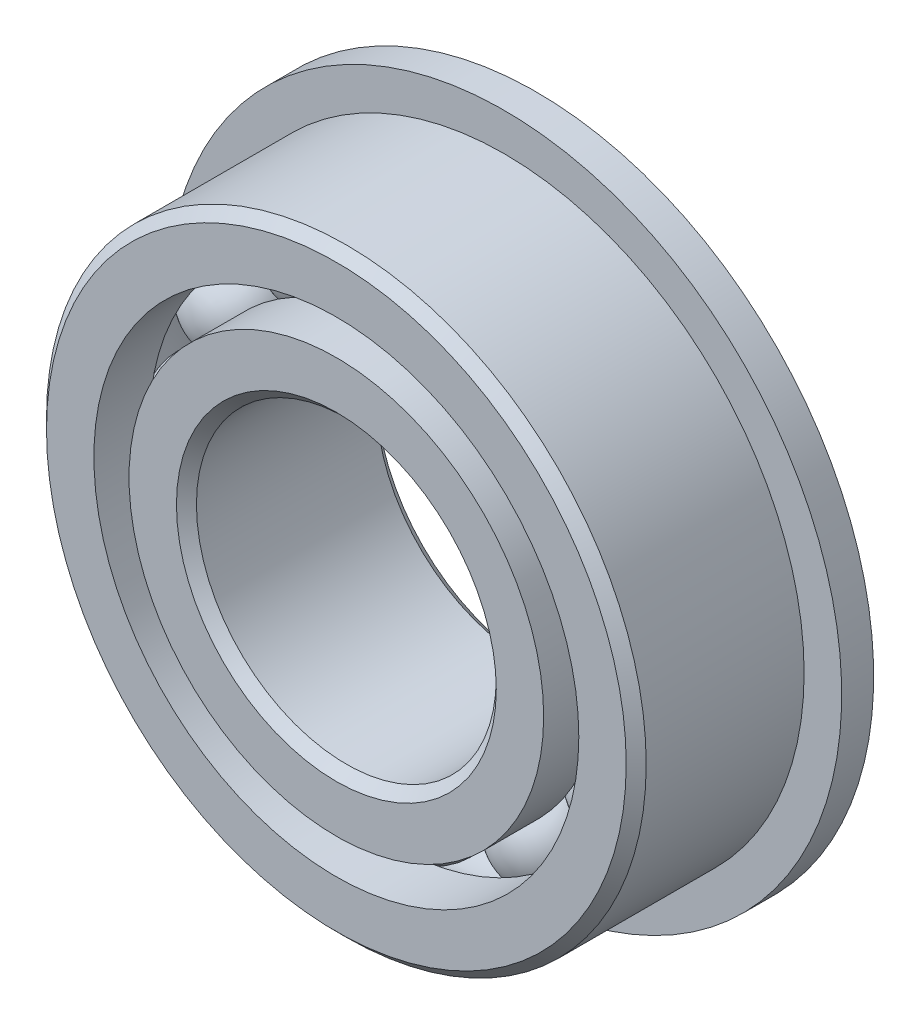
from build123d import *

# Parameters (mm, degrees)
CIRPATTERN1_COUNT = 12
SKETCH6_W         = 0.508
SKETCH6_H         = 1.508404121


with BuildPart() as part:
    # Sketch1 → Revolve1 (revolve)
    with BuildSketch(Plane(origin=(0, 0, 0), x_dir=(0, 0, -1), z_dir=(1, 0, 0))):
        with BuildLine():
            Line((1.42875, 4.7625), (-1.42875, 4.7625))
            Line((-1.42875, 4.7625), (-1.5875, 4.60375))
            Line((-1.5875, 4.60375), (-1.5875, 3.850995879))
            Line((-1.5875, 3.850995879), (-0.705555556, 3.850995879))
            ThreePointArc((-0.705555556, 3.850995879), (0, 4.330635244), (0.705555556, 3.850995879))
            Line((0.705555556, 3.850995879), (1.5875, 3.850995879))
            Line((1.5875, 3.850995879), (1.5875, 4.60375))
            Line((1.5875, 4.60375), (1.42875, 4.7625))
        make_face()
    revolve(axis=Axis((0, 0, 1.5875), (0, 0, -1)))

    # Sketch6 → Revolve6 (revolve)
    with BuildSketch(Plane(origin=(0, 0, 0), x_dir=(0, 0, -1), z_dir=(1, 0, 0))):
        with Locations((1.3335, 4.60519794)):
            Rectangle(SKETCH6_W, SKETCH6_H)
    revolve(axis=Axis((0, 0, -1.5875), (0, 0, 1)))


with BuildPart() as body_2:
    # Sketch3 → Revolve3 (revolve)
    with BuildSketch(Plane(origin=(0, 0, 0), x_dir=(0, 0, -1), z_dir=(1, 0, 0))):
        with BuildLine():
            Line((-1.5875, 3.292754121), (-0.705555556, 3.292754121))
            ThreePointArc((-0.705555556, 3.292754121), (0, 2.813114756), (0.705555556, 3.292754121))
            Line((0.705555556, 3.292754121), (1.5875, 3.292754121))
            Line((1.5875, 3.292754121), (1.5875, 2.54))
            Line((1.5875, 2.54), (1.42875, 2.38125))
            Line((1.42875, 2.38125), (-1.42875, 2.38125))
            Line((-1.42875, 2.38125), (-1.5875, 2.54))
            Line((-1.5875, 2.54), (-1.5875, 3.292754121))
        make_face()
    revolve(axis=Axis((0, 0, 1.5875), (0, 0, -1)))


with BuildPart() as body_3:
    # Sketch4 → Revolve4 (revolve)
    with BuildSketch(Plane(origin=(0, 0, 0), x_dir=(0, 0, -1), z_dir=(1, 0, 0))):
        with BuildLine():
            Line((-0.758760244, 3.571875), (0.758760244, 3.571875))
            ThreePointArc((0.758760244, 3.571875), (0, 4.330635244), (-0.758760244, 3.571875))
        make_face()
    revolve(axis=Axis((0, 3.571875, 0.758760244), (0, 0, -1)))


with BuildPart() as cirpattern1_1:
    # CirPattern1: pattern copy
    add(body_3.part.rotate(Axis((0, 0, -1.5875), (0, 0, 1)), 1 * 360 / CIRPATTERN1_COUNT))


with BuildPart() as cirpattern1_2:
    # CirPattern1: pattern copy
    add(body_3.part.rotate(Axis((0, 0, -1.5875), (0, 0, 1)), 2 * 360 / CIRPATTERN1_COUNT))


with BuildPart() as cirpattern1_3:
    # CirPattern1: pattern copy
    add(body_3.part.rotate(Axis((0, 0, -1.5875), (0, 0, 1)), 3 * 360 / CIRPATTERN1_COUNT))


with BuildPart() as cirpattern1_4:
    # CirPattern1: pattern copy
    add(body_3.part.rotate(Axis((0, 0, -1.5875), (0, 0, 1)), 4 * 360 / CIRPATTERN1_COUNT))


with BuildPart() as cirpattern1_5:
    # CirPattern1: pattern copy
    add(body_3.part.rotate(Axis((0, 0, -1.5875), (0, 0, 1)), 5 * 360 / CIRPATTERN1_COUNT))


with BuildPart() as cirpattern1_6:
    # CirPattern1: pattern copy
    add(body_3.part.rotate(Axis((0, 0, -1.5875), (0, 0, 1)), 6 * 360 / CIRPATTERN1_COUNT))


with BuildPart() as cirpattern1_7:
    # CirPattern1: pattern copy
    add(body_3.part.rotate(Axis((0, 0, -1.5875), (0, 0, 1)), 7 * 360 / CIRPATTERN1_COUNT))


with BuildPart() as cirpattern1_8:
    # CirPattern1: pattern copy
    add(body_3.part.rotate(Axis((0, 0, -1.5875), (0, 0, 1)), 8 * 360 / CIRPATTERN1_COUNT))


with BuildPart() as cirpattern1_9:
    # CirPattern1: pattern copy
    add(body_3.part.rotate(Axis((0, 0, -1.5875), (0, 0, 1)), 9 * 360 / CIRPATTERN1_COUNT))


with BuildPart() as cirpattern1_10:
    # CirPattern1: pattern copy
    add(body_3.part.rotate(Axis((0, 0, -1.5875), (0, 0, 1)), 10 * 360 / CIRPATTERN1_COUNT))


with BuildPart() as cirpattern1_11:
    # CirPattern1: pattern copy
    add(body_3.part.rotate(Axis((0, 0, -1.5875), (0, 0, 1)), 11 * 360 / CIRPATTERN1_COUNT))


solid = Compound([part.part, body_2.part, body_3.part, cirpattern1_1.part, cirpattern1_2.part, cirpattern1_3.part, cirpattern1_4.part, cirpattern1_5.part, cirpattern1_6.part, cirpattern1_7.part, cirpattern1_8.part, cirpattern1_9.part, cirpattern1_10.part, cirpattern1_11.part])
